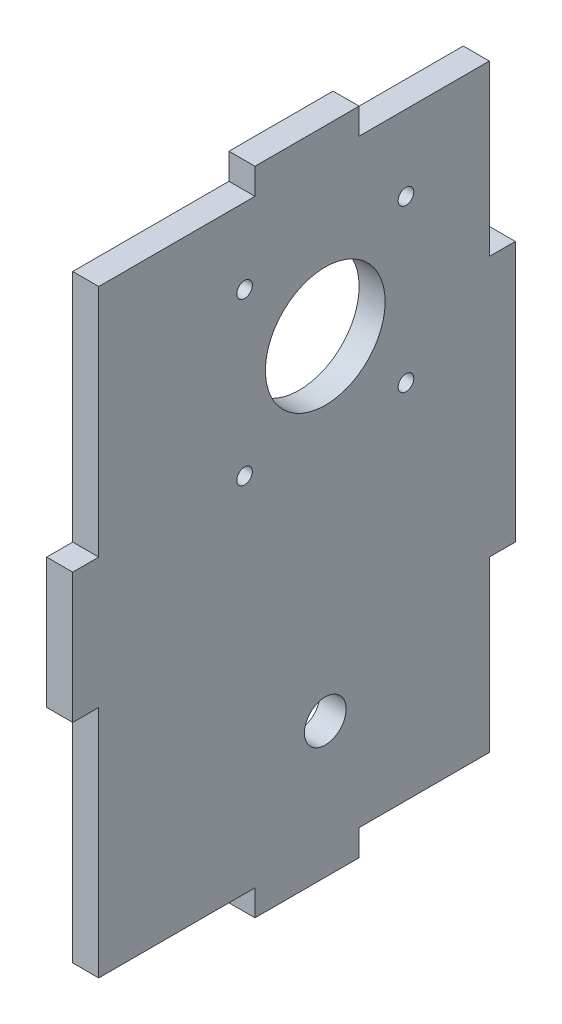
from build123d import *

# Parameters (mm, degrees)
SKETCH_1_R      = 4
SKETCH_1_R_2    = 11.5
SKETCH_1_R_3    = 1.5
EXTRUDE_1_DEPTH = 5


with BuildPart() as part:
    # 草图1 → 凸台-拉伸1 (new body)
    with BuildSketch(Plane(origin=(0, 0, 0), x_dir=(0, 0, -1), z_dir=(1, 0, 0))):
        Polygon((-80, 70), (-80, 115), (-50, 115), (-50, 120), (-30, 120), (-30, 115), (-5, 115), (-5, 82.5), (0, 82.5), (0, 32.5), (-5, 32.5), (-5, 0), (-30, 0), (-30, -5), (-50, -5), (-50, 0), (-80, 0), (-80, 45), (-85, 45), (-85, 70), align=None)
        with Locations((-36.5, 21)):
            Circle(SKETCH_1_R, mode=Mode.SUBTRACT)
        with Locations((-36.5, 85)):
            Circle(SKETCH_1_R_2, mode=Mode.SUBTRACT)
        with Locations((-52, 100.5)):
            Circle(SKETCH_1_R_3, mode=Mode.SUBTRACT)
        with Locations((-21, 100.5)):
            Circle(SKETCH_1_R_3, mode=Mode.SUBTRACT)
        with Locations((-21, 69.5)):
            Circle(SKETCH_1_R_3, mode=Mode.SUBTRACT)
        with Locations((-52, 69.5)):
            Circle(SKETCH_1_R_3, mode=Mode.SUBTRACT)
    extrude(amount=EXTRUDE_1_DEPTH)


solid = part.part
